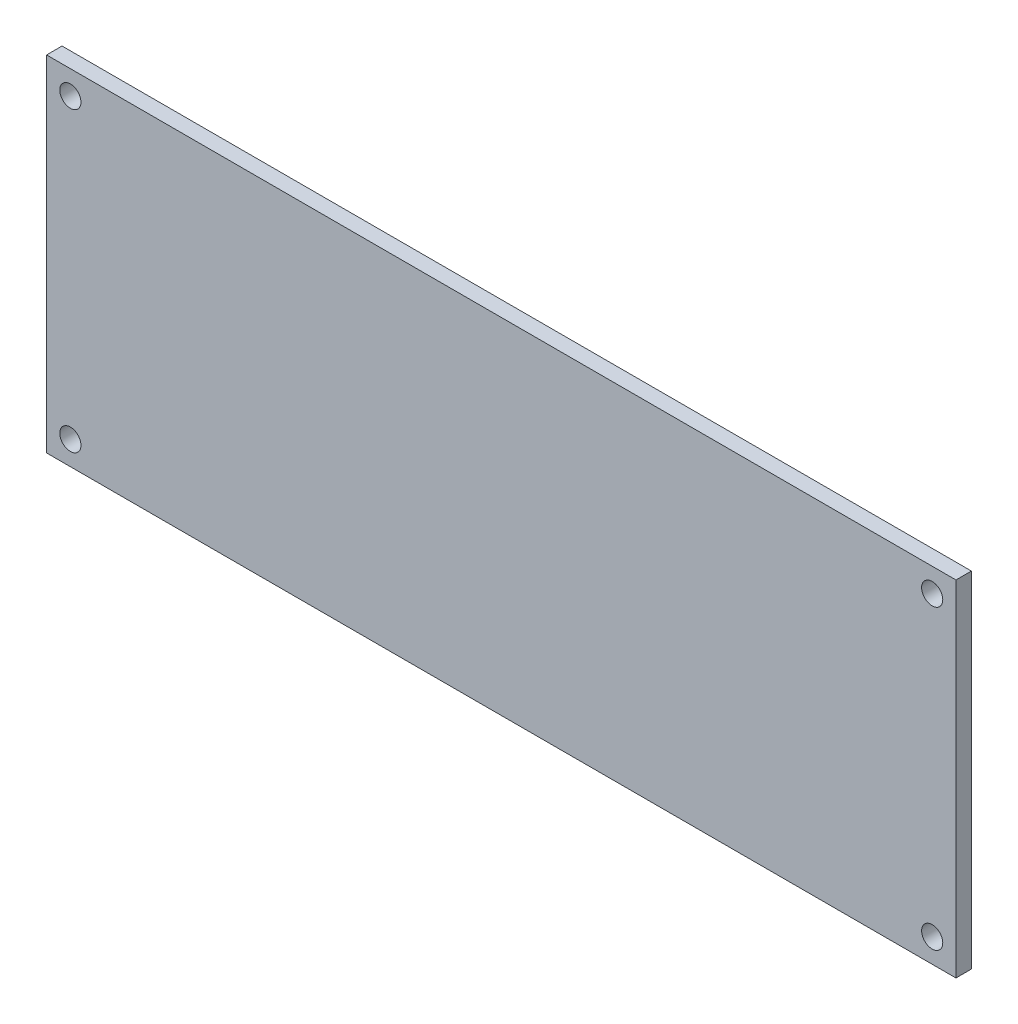
from build123d import *

# Parameters (mm, degrees)
SKETCH1_W                     = 97.155
SKETCH1_H                     = 36.83
BOSS_EXTRUDE1_DEPTH           = 1.651
TAP_DRILL_FOR_4_40_TAP1_D     = 2.2606
TAP_DRILL_FOR_4_40_TAP1_DEPTH = 12.7


with BuildPart() as part:
    # Sketch1 → Boss-Extrude1 (new body)
    with BuildSketch(Plane.XY):
        Rectangle(SKETCH1_W, SKETCH1_H)
    extrude(amount=BOSS_EXTRUDE1_DEPTH)

    # Tap Drill for #4-40 Tap1
    with Locations(Plane.XY.offset(1.651)):
        with Locations((-46.0375, 15.875), (-46.0375, -15.875), (46.0375, -15.875), (46.0375, 15.875)):
            Hole(TAP_DRILL_FOR_4_40_TAP1_D / 2, depth=TAP_DRILL_FOR_4_40_TAP1_DEPTH)


solid = part.part
